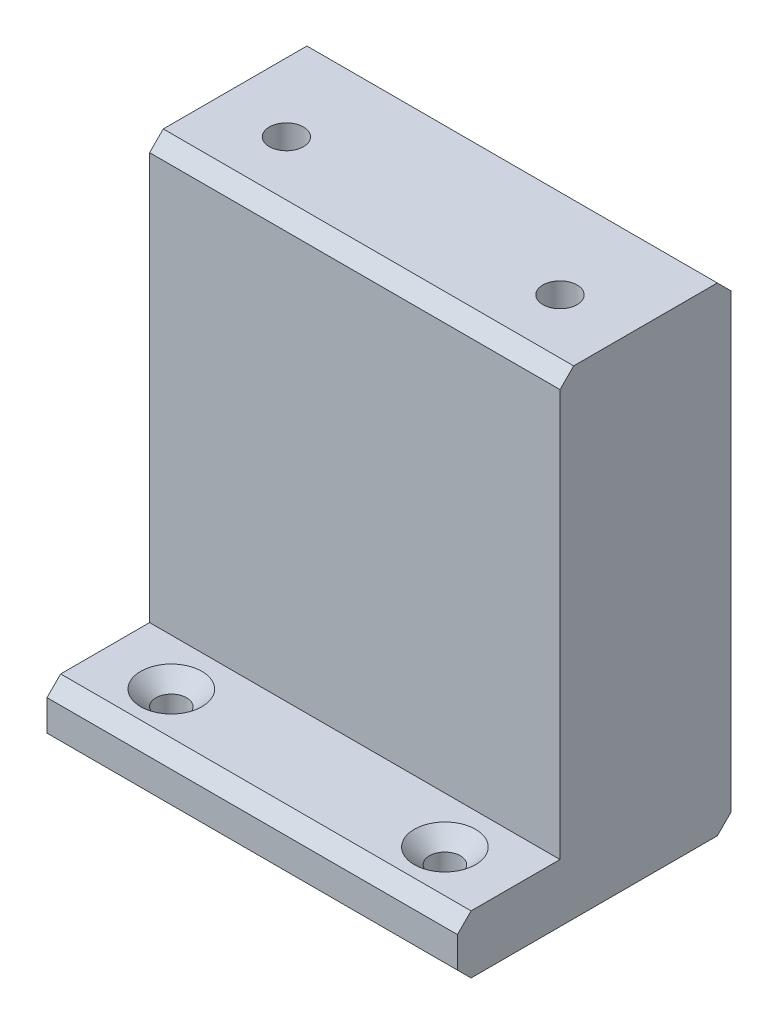
from build123d import *

# Parameters (mm, degrees)
SKETCH1_W                               = 60
SKETCH1_H                               = 40
BOSS_EXTRUDE1_DEPTH                     = 70
SKETCH2_W                               = 15
SKETCH2_H                               = 61.5
CUT_EXTRUDE1_DEPTH                      = 90
CSK_FOR_M4_SFHCS1_D                     = 4.5
CSK_FOR_M4_SFHCS1_CSINK_D               = 8.96
CSK_FOR_M4_SFHCS1_CSINK_ANGLE           = 90
CBORE_FOR_M5_HEX_HEAD_BOLT1_D           = 4.5
CBORE_FOR_M5_HEX_HEAD_BOLT1_DEPTH       = 10
CBORE_FOR_M5_HEX_HEAD_BOLT1_CBORE_D     = 5
CBORE_FOR_M5_HEX_HEAD_BOLT1_CBORE_DEPTH = 4.2
CBORE_FOR_M5_HEX_HEAD_BOLT1_TIP         = 1.351936393
CBORE_FOR_M5_HEX_HEAD_BOLT2_D           = 4.5
CBORE_FOR_M5_HEX_HEAD_BOLT2_DEPTH       = 10
CBORE_FOR_M5_HEX_HEAD_BOLT2_CBORE_D     = 5
CBORE_FOR_M5_HEX_HEAD_BOLT2_CBORE_DEPTH = 4.2
CBORE_FOR_M5_HEX_HEAD_BOLT2_TIP         = 1.351936393
CHAMFER2_SIZE                           = 2


with BuildPart() as part:
    # Sketch1 → Boss-Extrude1 (new body)
    with BuildSketch(Plane(origin=(0, 0, 0), x_dir=(1, 0, 0), z_dir=(0, 1, 0))):
        Rectangle(SKETCH1_W, SKETCH1_H)
    extrude(amount=BOSS_EXTRUDE1_DEPTH)

    # Sketch2 → Cut-Extrude1 (cut)
    with BuildSketch(Plane(origin=(30, 0, 0), x_dir=(0, 0, -1), z_dir=(1, 0, 0))):
        with Locations((-12.5, 39.25)):
            Rectangle(SKETCH2_W, SKETCH2_H)
    extrude(amount=-CUT_EXTRUDE1_DEPTH, mode=Mode.SUBTRACT)

    # CSK for M4 SFHCS1 (through all)
    with Locations(Plane(origin=(0, 8.5, 0), x_dir=(1, 0, 0), z_dir=(0, 1, 0))):
        with Locations((-20, -11.825), (20, -11.825)):
            CounterSinkHole(CSK_FOR_M4_SFHCS1_D / 2, CSK_FOR_M4_SFHCS1_CSINK_D / 2, counter_sink_angle=CSK_FOR_M4_SFHCS1_CSINK_ANGLE)

    # CBORE for M5 Hex Head Bolt1
    with Locations(Plane(origin=(0, 0, -20), x_dir=(-1, 0, 0), z_dir=(0, 0, -1))):
        with Locations((20, 55), (-20, 15), (-20, 55), (20, 15)):
            CounterBoreHole(CBORE_FOR_M5_HEX_HEAD_BOLT1_D / 2, CBORE_FOR_M5_HEX_HEAD_BOLT1_CBORE_D / 2, CBORE_FOR_M5_HEX_HEAD_BOLT1_CBORE_DEPTH, depth=CBORE_FOR_M5_HEX_HEAD_BOLT1_DEPTH)
            with Locations((0, 0, -(CBORE_FOR_M5_HEX_HEAD_BOLT1_DEPTH + CBORE_FOR_M5_HEX_HEAD_BOLT1_TIP / 2))):  # 118° drill point
                Cone(0, CBORE_FOR_M5_HEX_HEAD_BOLT1_D / 2, CBORE_FOR_M5_HEX_HEAD_BOLT1_TIP, mode=Mode.SUBTRACT)

    # CBORE for M5 Hex Head Bolt2
    with Locations(Plane(origin=(0, 70, 0), x_dir=(1, 0, 0), z_dir=(0, 1, 0))):
        with Locations((-20, 5), (20, 5)):
            CounterBoreHole(CBORE_FOR_M5_HEX_HEAD_BOLT2_D / 2, CBORE_FOR_M5_HEX_HEAD_BOLT2_CBORE_D / 2, CBORE_FOR_M5_HEX_HEAD_BOLT2_CBORE_DEPTH, depth=CBORE_FOR_M5_HEX_HEAD_BOLT2_DEPTH)
            with Locations((0, 0, -(CBORE_FOR_M5_HEX_HEAD_BOLT2_DEPTH + CBORE_FOR_M5_HEX_HEAD_BOLT2_TIP / 2))):  # 118° drill point
                Cone(0, CBORE_FOR_M5_HEX_HEAD_BOLT2_D / 2, CBORE_FOR_M5_HEX_HEAD_BOLT2_TIP, mode=Mode.SUBTRACT)

    # Chamfer2
    chamfer2_edges = [part.edges().sort_by_distance(p)[0] for p in [
        (0, 70, 5),
        (0, 8.5, 20),
        (0, 0, 20),
        (0, 0, -20),
        (0, 70, -20),
    ]]
    chamfer(chamfer2_edges, length=CHAMFER2_SIZE)


solid = part.part
